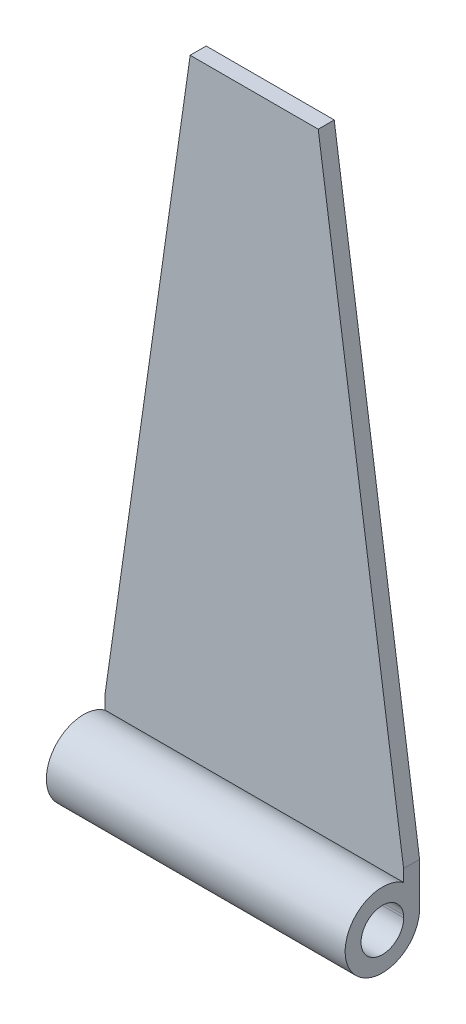
from build123d import *

# Parameters (mm, degrees)
BOSS_EXTRUDE1_DEPTH = 0.5953125
SKETCH2_R           = 2.7686
SKETCH2_R_2         = 1.5875
BOSS_EXTRUDE2_DEPTH = 11.1125


with BuildPart() as part:
    # Sketch1 → Boss-Extrude1 (new, symmetric)
    with BuildSketch(Plane.XY):
        Polygon((-11.1125, -20.6375), (-4.7625, 23.8125), (4.7625, 23.8125), (11.1125, -20.6375), (11.1125, -23.8125), (-11.1125, -23.8125), align=None)
    extrude(amount=BOSS_EXTRUDE1_DEPTH, both=True)

    # Sketch2 → Boss-Extrude2 (add, symmetric)
    with BuildSketch(Plane(origin=(0, 0, 0), x_dir=(0, 0, -1), z_dir=(1, 0, 0))):
        with Locations((-2.1732875, -23.8125)):
            Circle(SKETCH2_R)
        with Locations((-2.1732875, -23.8125)):
            Circle(SKETCH2_R_2, mode=Mode.SUBTRACT)
    extrude(amount=BOSS_EXTRUDE2_DEPTH, both=True)


solid = part.part
